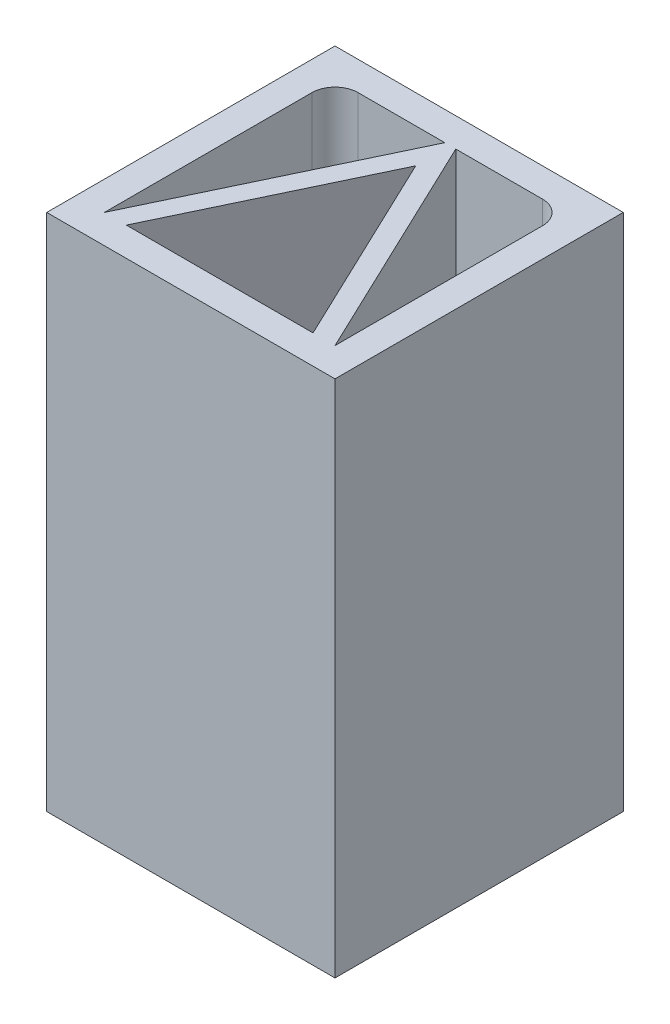
from build123d import *

# Parameters (mm, degrees)
SKETCH1_W           = 25
SKETCH1_H           = 25
SKETCH1_W_2         = 20
SKETCH1_H_2         = 20
BOSS_EXTRUDE1_DEPTH = 45
BOSS_EXTRUDE4_DEPTH = 45
FILLET2_R           = 2


with BuildPart() as part:
    # Sketch1 → Boss-Extrude1 (new body)
    with BuildSketch(Plane(origin=(0, 0, 0), x_dir=(1, 0, 0), z_dir=(0, 1, 0))):
        with Locations((12.5, 12.5)):
            Rectangle(SKETCH1_W, SKETCH1_H)
        with Locations((12.5, 12.5)):
            Rectangle(SKETCH1_W_2, SKETCH1_H_2, mode=Mode.SUBTRACT)
    extrude(amount=BOSS_EXTRUDE1_DEPTH)

    # Sketch3 → Boss-Extrude4 (add, through all)
    with BuildSketch(Plane.XZ):
        Polygon((22.5, -2.5), (12.5, -23.5), (2.5, -2.5), (4.404761905, -2.5), (12.5, -19.5), (20.595238095, -2.5), align=None)
    extrude(amount=-BOSS_EXTRUDE4_DEPTH)

    # Fillet2
    fillet2_edges = [part.edges().sort_by_distance(p)[0] for p in [
        (2.5, 22.5, -22.5),
        (22.5, 22.5, -22.5),
    ]]
    fillet(fillet2_edges, radius=FILLET2_R)


solid = part.part
